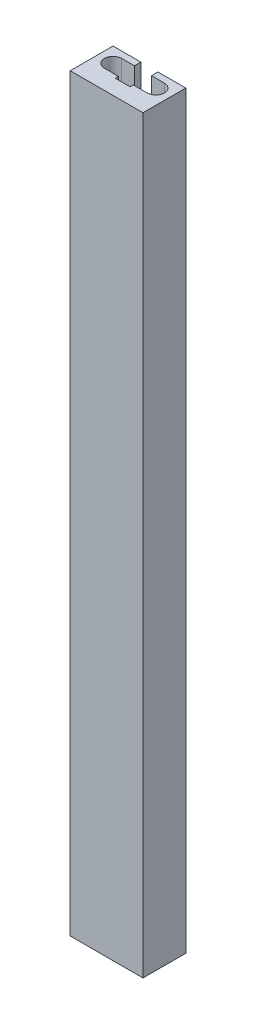
from build123d import *

# Parameters (mm, degrees)
SKETCH1_W           = 34
SKETCH1_H           = 350
BOSS_EXTRUDE1_DEPTH = 20
CUT_EXTRUDE1_DEPTH  = 330


with BuildPart() as part:
    # Sketch1 → Boss-Extrude1 (new body)
    with BuildSketch(Plane.XY):
        Rectangle(SKETCH1_W, SKETCH1_H)
    extrude(amount=BOSS_EXTRUDE1_DEPTH)

    # Sketch2 → Cut-Extrude1 (cut)
    with BuildSketch(Plane(origin=(0, 175, 0), x_dir=(1, 0, 0), z_dir=(0, 1, 0))):
        with BuildLine():
            Line((-10, -3), (-4, -3))
            Line((-4, -3), (-4, 0))
            Line((-4, 0), (4, 0))
            Line((4, 0), (4, -3))
            Line((4, -3), (10, -3))
            ThreePointArc((10, -3), (14, -7), (10, -11))
            Line((10, -11), (3.5, -11))
            Line((3.5, -11), (3.5, -12.5))
            Line((3.5, -12.5), (-3.5, -12.5))
            Line((-3.5, -12.5), (-3.5, -11))
            Line((-3.5, -11), (-10, -11))
            ThreePointArc((-10, -11), (-14, -7), (-10, -3))
        make_face()
    extrude(amount=-CUT_EXTRUDE1_DEPTH, mode=Mode.SUBTRACT)


solid = part.part
